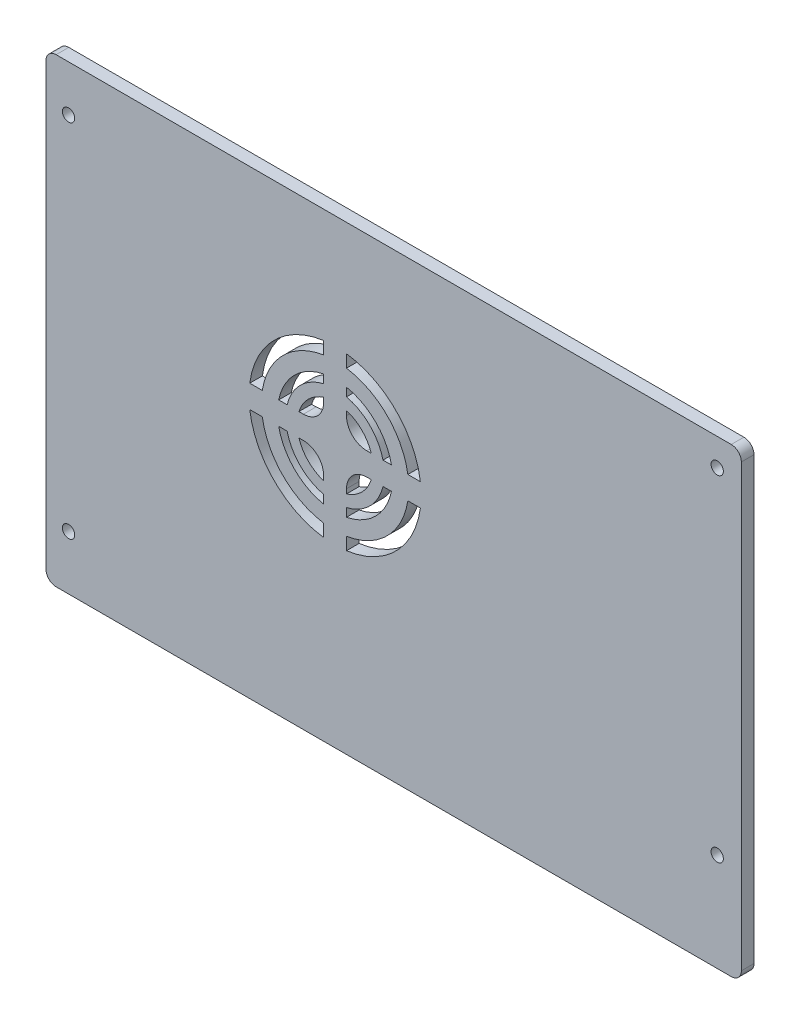
from build123d import *

# Parameters (mm, degrees)
SKETCH1_W           = 174.752
SKETCH1_H           = 115.824
SKETCH1_R           = 1.5494
BOSS_EXTRUDE2_DEPTH = 3.175
FILLET2_R           = 2.54


with BuildPart() as part:
    # Sketch1 → Boss-Extrude2 (new body)
    with BuildSketch(Plane.XY):
        with Locations((87.376, 57.912)):
            Rectangle(SKETCH1_W, SKETCH1_H)
        with BuildLine():
            Line((51.201113755, 62.918740671), (54.351132043, 62.918740671))
            ThreePointArc((54.351132043, 62.918740671), (59.551059271, 52.693059261), (69.776740685, 47.493132041))
            Line((69.776740685, 47.493132041), (69.776740685, 44.343113753))
            ThreePointArc((69.776740685, 44.343113753), (57.34663836, 50.48863835), (51.201113755, 62.918740671))
        make_face(mode=Mode.SUBTRACT)
        with BuildLine():
            Line((58.47906711, 62.918740671), (60.598040919, 62.918740671))
            ThreePointArc((60.598040919, 62.918740671), (63.888250287, 57.030250277), (69.776740685, 53.740040915))
            Line((69.776740685, 53.740040915), (69.776740685, 51.621067107))
            ThreePointArc((69.776740685, 51.621067107), (62.424741229, 55.566741219), (58.47906711, 62.918740671))
        make_face(mode=Mode.SUBTRACT)
        with BuildLine():
            ThreePointArc((69.776740685, 56.70280403), (65.908807914, 59.050807904), (63.560804035, 62.918740671))
            Line((63.560804035, 62.918740671), (64.696740685, 62.918740671))
            ThreePointArc((64.696740685, 62.918740671), (68.288843133, 61.43084312), (69.776740685, 57.838740671))
            Line((69.776740685, 57.838740671), (69.776740685, 56.70280403))
        make_face(mode=Mode.SUBTRACT)
        with BuildLine():
            ThreePointArc((75.511259315, 47.493132041), (85.736940729, 52.693059261), (90.936867957, 62.918740671))
            Line((90.936867957, 62.918740671), (94.086886245, 62.918740671))
            ThreePointArc((94.086886245, 62.918740671), (87.94136164, 50.48863835), (75.511259315, 44.343113753))
            Line((75.511259315, 44.343113753), (75.511259315, 47.493132041))
        make_face(mode=Mode.SUBTRACT)
        with BuildLine():
            ThreePointArc((75.511259315, 53.740040915), (81.399749713, 57.030250277), (84.689959081, 62.918740671))
            Line((84.689959081, 62.918740671), (86.80893289, 62.918740671))
            ThreePointArc((86.80893289, 62.918740671), (82.863258771, 55.566741219), (75.511259315, 51.621067107))
            Line((75.511259315, 51.621067107), (75.511259315, 53.740040915))
        make_face(mode=Mode.SUBTRACT)
        with BuildLine():
            Line((80.591259315, 62.918740671), (81.727195965, 62.918740671))
            ThreePointArc((81.727195965, 62.918740671), (79.379192086, 59.050807904), (75.511259315, 56.70280403))
            Line((75.511259315, 56.70280403), (75.511259315, 57.838740671))
            ThreePointArc((75.511259315, 57.838740671), (76.999156867, 61.43084312), (80.591259315, 62.918740671))
        make_face(mode=Mode.SUBTRACT)
        with BuildLine():
            Line((64.696740685, 68.653259329), (63.560804035, 68.653259329))
            ThreePointArc((63.560804035, 68.653259329), (65.908807914, 72.521192096), (69.776740685, 74.86919597))
            Line((69.776740685, 74.86919597), (69.776740685, 73.733259329))
            ThreePointArc((69.776740685, 73.733259329), (68.288843133, 70.14115688), (64.696740685, 68.653259329))
        make_face(mode=Mode.SUBTRACT)
        with BuildLine():
            Line((69.776740685, 79.950932893), (69.776740685, 77.831959085))
            ThreePointArc((69.776740685, 77.831959085), (63.888250287, 74.541749723), (60.598040919, 68.653259329))
            Line((60.598040919, 68.653259329), (58.47906711, 68.653259329))
            ThreePointArc((58.47906711, 68.653259329), (62.424741229, 76.005258781), (69.776740685, 79.950932893))
        make_face(mode=Mode.SUBTRACT)
        with BuildLine():
            ThreePointArc((69.776740685, 84.078867959), (59.551059271, 78.878940739), (54.351132043, 68.653259329))
            Line((54.351132043, 68.653259329), (51.201113755, 68.653259329))
            ThreePointArc((51.201113755, 68.653259329), (57.34663836, 81.08336165), (69.776740685, 87.228886247))
            Line((69.776740685, 87.228886247), (69.776740685, 84.078867959))
        make_face(mode=Mode.SUBTRACT)
        with BuildLine():
            Line((75.511259315, 73.733259329), (75.511259315, 74.86919597))
            ThreePointArc((75.511259315, 74.86919597), (79.379192086, 72.521192096), (81.727195965, 68.653259329))
            Line((81.727195965, 68.653259329), (80.591259315, 68.653259329))
            ThreePointArc((80.591259315, 68.653259329), (76.999156867, 70.14115688), (75.511259315, 73.733259329))
        make_face(mode=Mode.SUBTRACT)
        with BuildLine():
            Line((86.80893289, 68.653259329), (84.689959081, 68.653259329))
            ThreePointArc((84.689959081, 68.653259329), (81.399749713, 74.541749723), (75.511259315, 77.831959085))
            Line((75.511259315, 77.831959085), (75.511259315, 79.950932893))
            ThreePointArc((75.511259315, 79.950932893), (82.863258771, 76.005258781), (86.80893289, 68.653259329))
        make_face(mode=Mode.SUBTRACT)
        with BuildLine():
            ThreePointArc((90.936867957, 68.653259329), (85.736940729, 78.878940739), (75.511259315, 84.078867959))
            Line((75.511259315, 84.078867959), (75.511259315, 87.228886247))
            ThreePointArc((75.511259315, 87.228886247), (87.94136164, 81.08336165), (94.086886245, 68.653259329))
            Line((94.086886245, 68.653259329), (90.936867957, 68.653259329))
        make_face(mode=Mode.SUBTRACT)
        with Locations((5.6642, 13.6144)):
            Circle(SKETCH1_R, mode=Mode.SUBTRACT)
        with Locations((168.6814, 24.6888)):
            Circle(SKETCH1_R, mode=Mode.SUBTRACT)
        with Locations((5.6642, 104.267)):
            Circle(SKETCH1_R, mode=Mode.SUBTRACT)
        with Locations((168.6814, 108.966)):
            Circle(SKETCH1_R, mode=Mode.SUBTRACT)
    extrude(amount=BOSS_EXTRUDE2_DEPTH)

    # Fillet2
    fillet2_edges = [part.edges().sort_by_distance(p)[0] for p in [
        (174.752, 0, 1.5875),
        (0, 0, 1.5875),
        (0, 115.824, 1.5875),
        (174.752, 115.824, 1.5875),
    ]]
    fillet(fillet2_edges, radius=FILLET2_R)


solid = part.part
